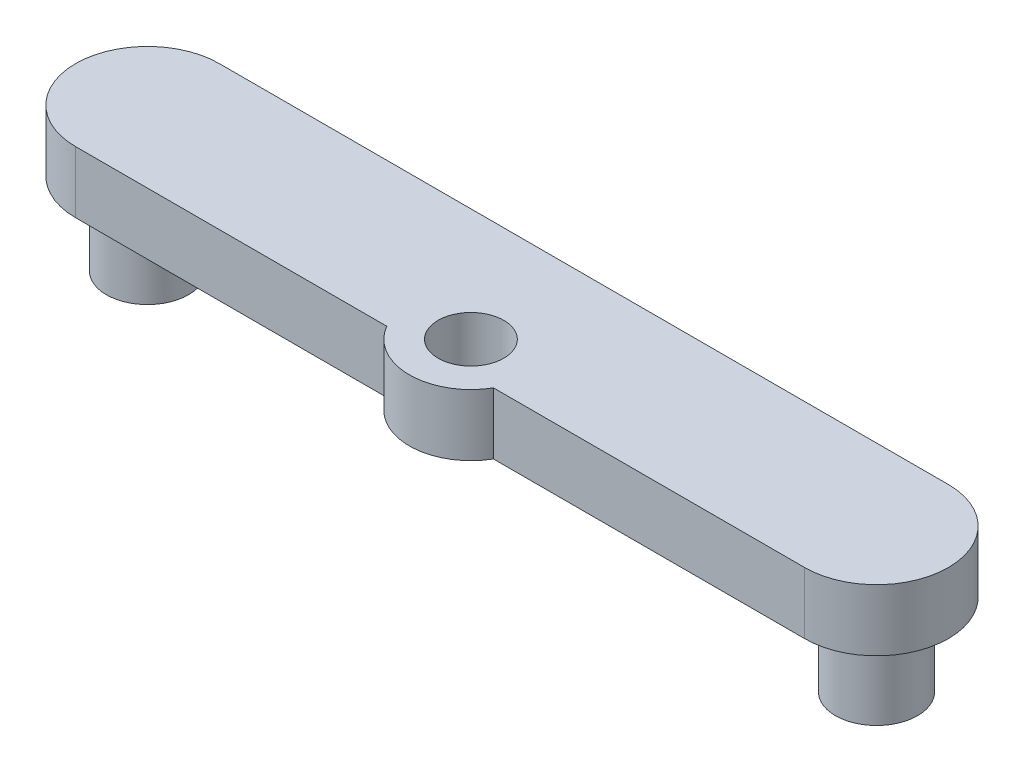
from build123d import *

# Parameters (mm, degrees)
SKETCH1_R           = 1.6
BOSS_EXTRUDE1_DEPTH = 3
SKETCH2_R           = 2
BOSS_EXTRUDE2_DEPTH = 4


with BuildPart() as part:
    # Sketch1 → Boss-Extrude1 (new body)
    with BuildSketch(Plane(origin=(0, 0, 0), x_dir=(1, 0, 0), z_dir=(0, 1, 0))):
        with BuildLine():
            Line((2.598076211, -3.5), (17.75, -3.5))
            ThreePointArc((17.75, -3.5), (21.25, 0), (17.75, 3.5))
            Line((17.75, 3.5), (-17.75, 3.5))
            ThreePointArc((-17.75, 3.5), (-21.25, 0), (-17.75, -3.5))
            Line((-17.75, -3.5), (-2.598076211, -3.5))
            ThreePointArc((-2.598076211, -3.5), (0, -5), (2.598076211, -3.5))
        make_face()
        with Locations(Location((0, -2, 0), (0, 0, 270))):
            Circle(SKETCH1_R, mode=Mode.SUBTRACT)
    extrude(amount=BOSS_EXTRUDE1_DEPTH)

    # Sketch2 → Boss-Extrude2 (add)
    with BuildSketch(Plane.XZ):
        with Locations(Location((-17.75, 0, 0), (0, 0, 90))):
            Circle(SKETCH2_R)
        with Locations(Location((17.75, 0, 0), (0, 0, 90))):
            Circle(SKETCH2_R)
    extrude(amount=BOSS_EXTRUDE2_DEPTH)


solid = part.part
